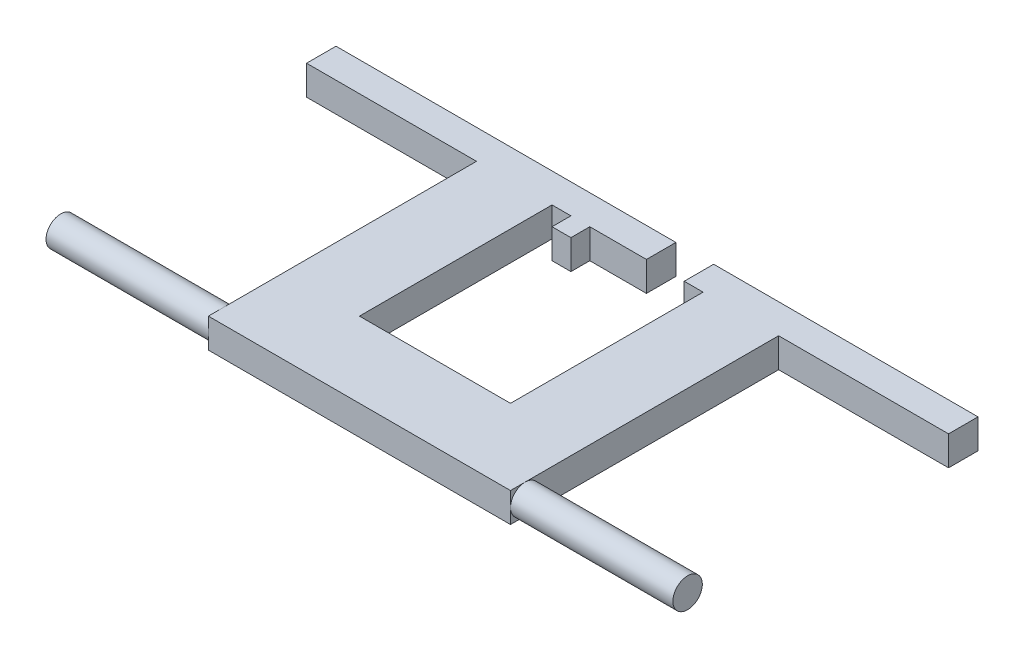
from build123d import *

# Parameters (mm, degrees)
SKETCH1_W           = 170
SKETCH1_H           = 7.8
BOSS_EXTRUDE1_DEPTH = 7.8
SKETCH2_W           = 20
SKETCH2_H           = 7.8
BOSS_EXTRUDE2_DEPTH = 71
SKETCH3_R           = 3.9
BOSS_EXTRUDE3_DEPTH = 43
SKETCH4_W           = 20
SKETCH4_H           = 7.8
BOSS_EXTRUDE4_DEPTH = 25
SKETCH5_W           = 10
SKETCH5_H           = 7.8
CUT_EXTRUDE1_DEPTH  = 119.646151442
SKETCH6_W           = 5
SKETCH6_H           = 7.8
BOSS_EXTRUDE5_DEPTH = 5


with BuildPart() as part:
    # Sketch1 → Boss-Extrude1 (new body)
    with BuildSketch(Plane(origin=(0, 0, 0), x_dir=(1, 0, 0), z_dir=(0, 1, 0))):
        with Locations((9.736842105, 9.155198973)):
            Rectangle(SKETCH1_W, SKETCH1_H)
    extrude(amount=BOSS_EXTRUDE1_DEPTH)

    # Sketch2 → Boss-Extrude2 (add)
    with BuildSketch(Plane.XY.offset(-5.255198973)):
        with Locations((-20.263157895, 3.9)):
            Rectangle(SKETCH2_W, SKETCH2_H)
    boss_extrude2 = extrude(amount=BOSS_EXTRUDE2_DEPTH)

    # Sketch3 → Boss-Extrude3 (add)
    with BuildSketch(Plane.ZY.offset(30.263157895)):
        with Locations((61.844801027, 3.9)):
            Circle(SKETCH3_R)
    boss_extrude3 = extrude(amount=BOSS_EXTRUDE3_DEPTH)

    # Sketch4 → Boss-Extrude4 (add)
    with BuildSketch(Plane(origin=(-10.263157895, 0, 0), x_dir=(0, 0, -1), z_dir=(1, 0, 0))):
        with Locations((-55.744801027, 3.9)):
            Rectangle(SKETCH4_W, SKETCH4_H)
    boss_extrude4 = extrude(amount=BOSS_EXTRUDE4_DEPTH)

    # Mirror1: Boss-Extrude2, Boss-Extrude3, Boss-Extrude4 across plane
    add(boss_extrude2.mirror(Plane.ZY.offset(-9.736842105)))
    add(boss_extrude3.mirror(Plane.ZY.offset(-9.736842105)))
    add(boss_extrude4.mirror(Plane.ZY.offset(-9.736842105)))

    # Sketch5 → Cut-Extrude1 (cut, through all)
    with BuildSketch(Plane.XY.offset(-5.255198973)):
        with Locations((19.736842105, 3.9)):
            Rectangle(SKETCH5_W, SKETCH5_H)
    extrude(amount=-CUT_EXTRUDE1_DEPTH, mode=Mode.SUBTRACT)

    # Sketch6 → Boss-Extrude5 (add)
    with BuildSketch(Plane.XY.offset(-5.255198973)):
        with Locations((-2.763157895, 3.9)):
            Rectangle(SKETCH6_W, SKETCH6_H)
    extrude(amount=BOSS_EXTRUDE5_DEPTH)


solid = part.part
